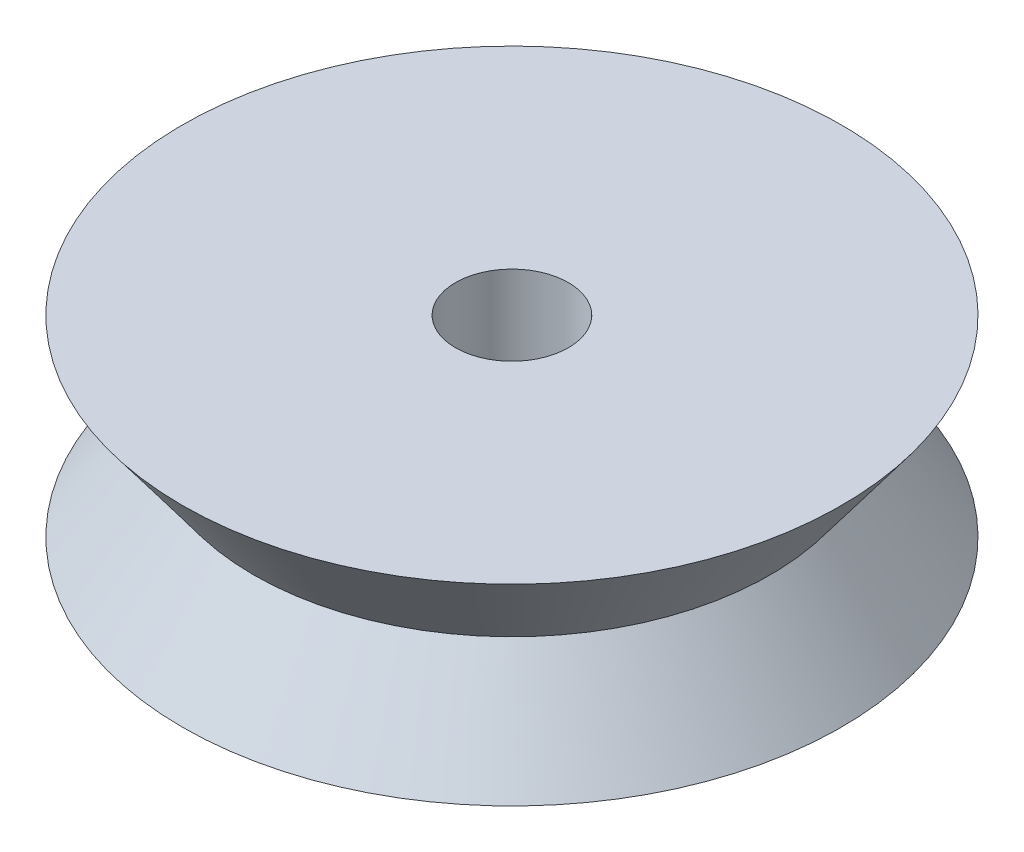
from build123d import *


with BuildPart() as part:
    # Croquis1 → Revolución1 (revolve)
    with BuildSketch(Plane.XY, mode=Mode.PRIVATE) as revoluci_n1_sk:
        Polygon((-5, 0), (-5, 8.5), (-29.175, 8.5), (-22.85, 0), align=None)
        Polygon((-5, -8.5), (-5, 0), (-22.85, 0), (-29.175, -8.5), align=None)
    revolve(revoluci_n1_sk.sketch.rotate(Axis((0, 10.48411544, 0), (0, -1, 0)), 270), axis=Axis((0, 10.48411544, 0), (0, -1, 0)))


solid = part.part
